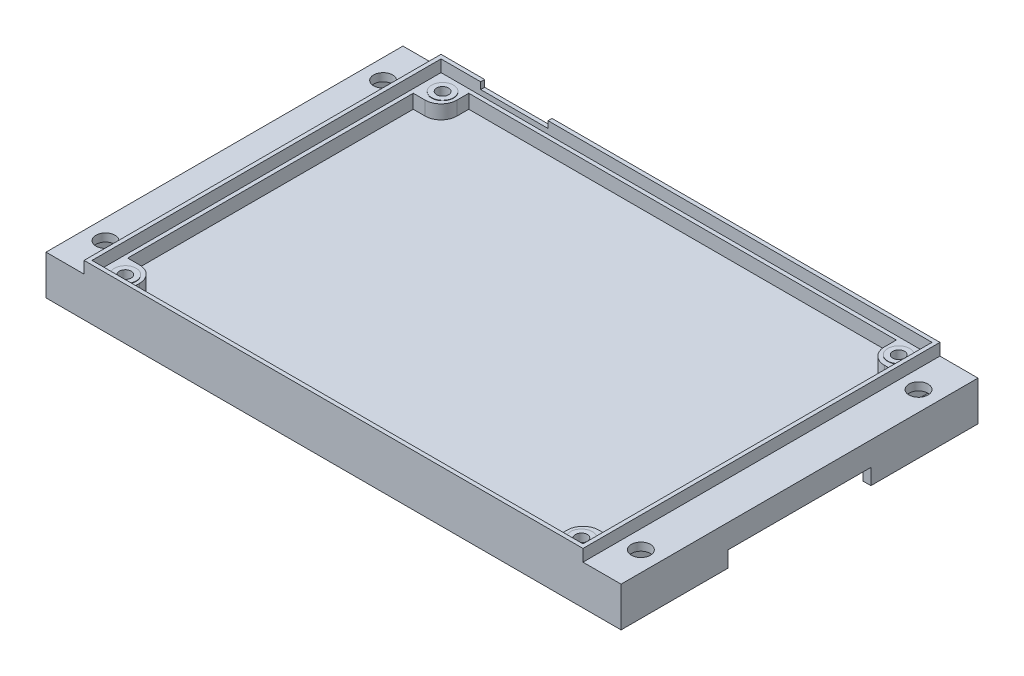
from build123d import *

# Parameters (mm, degrees)
SKETCH_1_W           = 145
SKETCH_1_H           = 90
EXTRUDE_1_DEPTH      = 10
SKETCH_2_W           = 125.8
SKETCH_2_H           = 90
EXTRUDE_2_DEPTH      = 3
SKETCH_3_W           = 123.8
SKETCH_3_H           = 88
CUT_EXTRUDE_1_DEPTH  = 3
CUT_EXTRUDE_2_DEPTH  = 3.5
SKETCH_6_W           = 141
SKETCH_6_H           = 86
CUT_EXTRUDE_3_DEPTH  = 4
SKETCH_7_W           = 36
SKETCH_7_H           = 6
CUT_EXTRUDE_4_DEPTH  = 153.377819908
SKETCH_8_W           = 7
SKETCH_8_H           = 86
CUT_EXTRUDE_5_DEPTH  = 4
EXTRUDE_6_DEPTH      = 4
EXTRUDE_7_DEPTH      = 4
EXTRUDE_8_DEPTH      = 0.1
EXTRUDE_8_DEPTH_BACK = 6.1
SKETCH_16_R          = 2.75
SKETCH_17_R          = 1.5
CUT_EXTRUDE_8_DEPTH  = 86.925898308
SKETCH_18_R          = 2.4
CUT_EXTRUDE_9_DEPTH  = 86.914201387
SKETCH_19_W          = 17
SKETCH_19_H          = 2.7
CUT_EXTRUDE_10_DEPTH = 3


with BuildPart() as part:
    # Эскиз1 → Бобышка-Вытянуть1 (new body)
    with BuildSketch(Plane(origin=(0, 0, 0), x_dir=(1, 0, 0), z_dir=(0, 1, 0))):
        Rectangle(SKETCH_1_W, SKETCH_1_H)
    extrude(amount=EXTRUDE_1_DEPTH)

    # Эскиз2 → Бобышка-Вытянуть2 (add)
    with BuildSketch(Plane(origin=(0, 10, 0), x_dir=(1, 0, 0), z_dir=(0, 1, 0))):
        Rectangle(SKETCH_2_W, SKETCH_2_H)
    extrude(amount=EXTRUDE_2_DEPTH)

    # Эскиз3 → Вырез-Вытянуть1 (cut)
    with BuildSketch(Plane(origin=(0, 13, 0), x_dir=(1, 0, 0), z_dir=(0, 1, 0))):
        Rectangle(SKETCH_3_W, SKETCH_3_H)
    extrude(amount=-CUT_EXTRUDE_1_DEPTH, mode=Mode.SUBTRACT)

    # Эскиз4 → Вырез-Вытянуть2 (cut)
    with BuildSketch(Plane(origin=(0, 10, 0), x_dir=(1, 0, 0), z_dir=(0, 1, 0))):
        with BuildLine():
            Line((-53.9, 43), (53.9, 43))
            Line((53.9, 43), (53.9, 40))
            ThreePointArc((53.9, 40), (55.071572875, 37.171572875), (57.9, 36))
            Line((57.9, 36), (60.9, 36))
            Line((60.9, 36), (60.9, -36))
            Line((60.9, -36), (57.9, -36))
            ThreePointArc((57.9, -36), (55.071572875, -37.171572875), (53.9, -40))
            Line((53.9, -40), (53.9, -43))
            Line((53.9, -43), (-53.9, -43))
            Line((-53.9, -43), (-53.9, -40))
            ThreePointArc((-53.9, -40), (-55.071572875, -37.171572875), (-57.9, -36))
            Line((-57.9, -36), (-60.9, -36))
            Line((-60.9, -36), (-60.9, 36))
            Line((-60.9, 36), (-57.9, 36))
            ThreePointArc((-57.9, 36), (-55.071572875, 37.171572875), (-53.9, 40))
            Line((-53.9, 40), (-53.9, 43))
        make_face()
    extrude(amount=-CUT_EXTRUDE_2_DEPTH, mode=Mode.SUBTRACT)

    # Эскиз6 → Вырез-Вытянуть3 (cut)
    with BuildSketch(Plane.XZ):
        Rectangle(SKETCH_6_W, SKETCH_6_H)
    extrude(amount=-CUT_EXTRUDE_3_DEPTH, mode=Mode.SUBTRACT)

    # Эскиз7 → Вырез-Вытянуть4 (cut, through all)
    with BuildSketch(Plane(origin=(72.5, 0, 0), x_dir=(0, 0, -1), z_dir=(1, 0, 0))):
        with Locations((0, 1)):
            Rectangle(SKETCH_7_W, SKETCH_7_H)
    extrude(amount=-CUT_EXTRUDE_4_DEPTH, mode=Mode.SUBTRACT)

    # Эскиз8 → Вырез-Вытянуть5 (cut)
    with BuildSketch(Plane.XZ.offset(-4)):
        with Locations((-67, 0)):
            Rectangle(SKETCH_8_W, SKETCH_8_H)
        with Locations((67, 0)):
            Rectangle(SKETCH_8_W, SKETCH_8_H)
    extrude(amount=-CUT_EXTRUDE_5_DEPTH, mode=Mode.SUBTRACT)

    # Эскиз14 → Бобышка-Вытянуть6 (add)
    with BuildSketch(Plane.XZ.offset(-4)):
        Polygon((-63.5, -37), (-63.5, -18), (63.5, -18), (63.5, -37), (61.5, -37), (61.5, -20), (14.5, -20), (14.5, -43), (12.5, -43), (12.5, -20), (-12.5, -20), (-12.5, -43), (-14.5, -43), (-14.5, -20), (-61.5, -20), (-61.5, -37), align=None)
    extrude(amount=EXTRUDE_6_DEPTH)

    # Эскиз15 → Бобышка-Вытянуть7 (add)
    with BuildSketch(Plane.XZ.offset(-4)):
        Polygon((-61.5, 37), (-63.5, 37), (-63.5, 18), (-50.5, 18), (-50.5, 43), (-55.5, 43), (-55.5, 20), (-61.5, 20), align=None)
        Polygon((63.5, 37), (63.5, 18), (50.5, 18), (50.5, 43), (55.5, 43), (55.5, 20), (61.5, 20), (61.5, 37), align=None)
        Polygon((-13.5, 43), (-13.5, 18), (13.5, 18), (13.5, 43), (8.5, 43), (8.5, 20), (-8.5, 20), (-8.5, 43), align=None)
    extrude(amount=EXTRUDE_7_DEPTH)

    # Эскиз16 → Бобышка-Вытянуть8 (add, two sides: drawn at the far end of the back side and taken through both)
    with BuildSketch(Plane(origin=(0, 10, 0), x_dir=(1, 0, 0), z_dir=(0, 1, 0)).offset(-EXTRUDE_8_DEPTH_BACK)):
        with Locations(Location((-57.5, 40, 0), (0, 0, 270))):
            Circle(SKETCH_16_R)
        with Locations(Location((57.5, 40, 0), (0, 0, 270))):
            Circle(SKETCH_16_R)
        with Locations(Location((-57.5, -40, 0), (0, 0, 270))):
            Circle(SKETCH_16_R)
        with Locations(Location((57.5, -40, 0), (0, 0, 270))):
            Circle(SKETCH_16_R)
    extrude(amount=EXTRUDE_8_DEPTH + EXTRUDE_8_DEPTH_BACK)

    # Эскиз17 → Вырез-Вытянуть8 (cut, through all)
    with BuildSketch(Plane(origin=(0, 10.1, 0), x_dir=(1, 0, 0), z_dir=(0, 1, 0))):
        with Locations(Location((-57.5, 40, 0), (0, 0, 270))):
            Circle(SKETCH_17_R)
        with Locations(Location((57.5, 40, 0), (0, 0, 270))):
            Circle(SKETCH_17_R)
        with Locations(Location((-57.5, -40, 0), (0, 0, 270))):
            Circle(SKETCH_17_R)
        with Locations(Location((57.5, -40, 0), (0, 0, 270))):
            Circle(SKETCH_17_R)
    extrude(amount=-CUT_EXTRUDE_8_DEPTH, mode=Mode.SUBTRACT)

    # Эскиз18 → Вырез-Вытянуть9 (cut, through all)
    with BuildSketch(Plane(origin=(0, 10, 0), x_dir=(1, 0, 0), z_dir=(0, 1, 0))):
        with Locations(Location((-67.5, 35, 0), (0, 0, 270))):
            Circle(SKETCH_18_R)
        with Locations(Location((-67.5, -35, 0), (0, 0, 270))):
            Circle(SKETCH_18_R)
        with Locations(Location((67.5, 35, 0), (0, 0, 270))):
            Circle(SKETCH_18_R)
        with Locations(Location((67.5, -35, 0), (0, 0, 270))):
            Circle(SKETCH_18_R)
    extrude(amount=-CUT_EXTRUDE_9_DEPTH, mode=Mode.SUBTRACT)

    # Эскиз19 → Вырез-Вытянуть10 (cut)
    with BuildSketch(Plane(origin=(0, 0, -45), x_dir=(-1, 0, 0), z_dir=(0, 0, -1))):
        with Locations((43.4, 12.65)):
            Rectangle(SKETCH_19_W, SKETCH_19_H)
    extrude(amount=-CUT_EXTRUDE_10_DEPTH, mode=Mode.SUBTRACT)


solid = part.part
